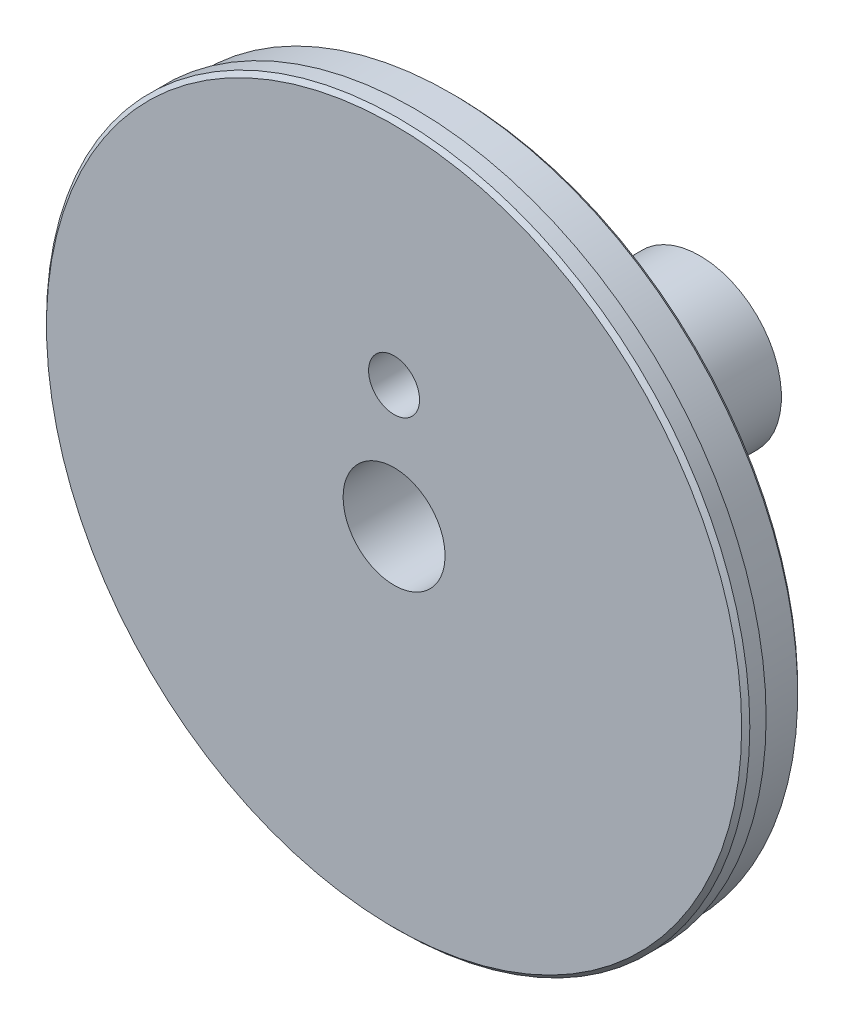
from build123d import *

# Parameters (mm, degrees)
SKETCH1_R           = 17.25
BOSS_EXTRUDE1_DEPTH = 1
SKETCH2_R           = 17
BOSS_EXTRUDE2_DEPTH = 2
SKETCH3_R           = 9
BOSS_EXTRUDE3_DEPTH = 3
SKETCH4_R           = 4
BOSS_EXTRUDE4_DEPTH = 9
SKETCH5_R           = 2.5
CUT_EXTRUDE1_DEPTH  = 29.637824638
SKETCH6_R           = 1.25
CUT_EXTRUDE2_DEPTH  = 27.002403735
CHAMFER1_SIZE       = 0.2


with BuildPart() as part:
    # Sketch1 → Boss-Extrude1 (new body)
    with BuildSketch(Plane.XY):
        Circle(SKETCH1_R)
    extrude(amount=BOSS_EXTRUDE1_DEPTH)

    # Sketch2 → Boss-Extrude2 (add)
    with BuildSketch(Plane(origin=(0, 0, 0), x_dir=(-1, 0, 0), z_dir=(0, 0, -1))):
        Circle(SKETCH2_R)
    extrude(amount=BOSS_EXTRUDE2_DEPTH)

    # Sketch3 → Boss-Extrude3 (add)
    with BuildSketch(Plane(origin=(0, 0, -2), x_dir=(-1, 0, 0), z_dir=(0, 0, -1))):
        Circle(SKETCH3_R)
    extrude(amount=BOSS_EXTRUDE3_DEPTH)

    # Sketch4 → Boss-Extrude4 (add)
    with BuildSketch(Plane(origin=(0, 0, -5), x_dir=(-1, 0, 0), z_dir=(0, 0, -1))):
        Circle(SKETCH4_R)
    extrude(amount=BOSS_EXTRUDE4_DEPTH)

    # Sketch5 → Cut-Extrude1 (cut, through all)
    with BuildSketch(Plane(origin=(0, 0, -14), x_dir=(-1, 0, 0), z_dir=(0, 0, -1))):
        Circle(SKETCH5_R)
    extrude(amount=-CUT_EXTRUDE1_DEPTH, mode=Mode.SUBTRACT)

    # Sketch6 → Cut-Extrude2 (cut, through all)
    with BuildSketch(Plane(origin=(0, 0, -5), x_dir=(-1, 0, 0), z_dir=(0, 0, -1))):
        with Locations((0, 6)):
            Circle(SKETCH6_R)
    extrude(amount=-CUT_EXTRUDE2_DEPTH, mode=Mode.SUBTRACT)

    # Chamfer1
    chamfer1_edges = [part.edges().sort_by_distance(p)[0] for p in [
        (9, 0, -5),
        (2.5, 0, -14),
        (-17.25, 0, 1),
        (17, 0, -2),
    ]]
    chamfer(chamfer1_edges, length=CHAMFER1_SIZE)


solid = part.part
